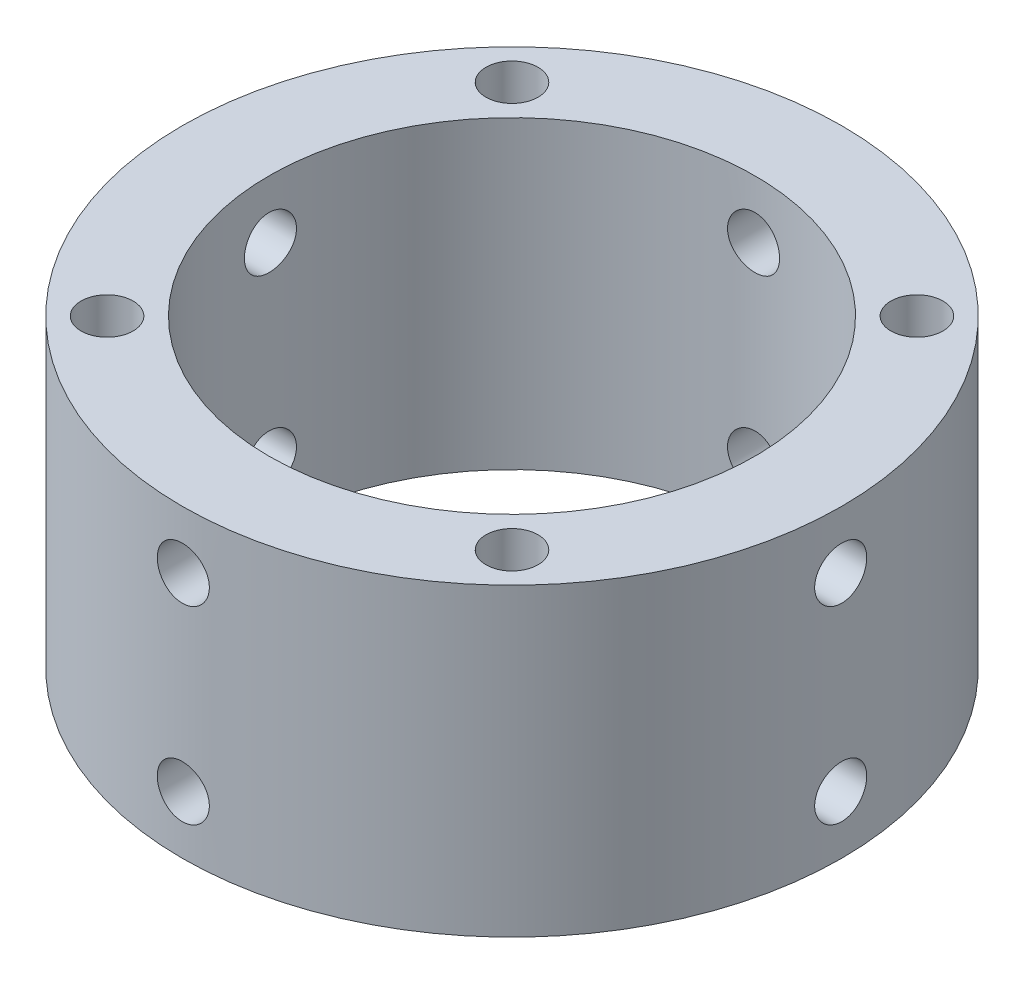
from build123d import *

# Parameters (mm, degrees)
SKETCH1_R           = 28.5
SKETCH1_R_2         = 21
BOSS_EXTRUDE1_DEPTH = 13.175
SKETCH2_R           = 2.25
CUT_EXTRUDE1_DEPTH  = 43.403780787
CIRPATTERN1_COUNT   = 4
SKETCH3_R           = 2.25
CUT_EXTRUDE2_DEPTH  = 49.154153681


with BuildPart() as part:
    # Sketch1 → Boss-Extrude1 (new, symmetric)
    with BuildSketch(Plane(origin=(0, 0, 0), x_dir=(1, 0, 0), z_dir=(0, 1, 0))):
        with Locations(Location((0, 0, 0), (0, 0, 90))):
            Circle(SKETCH1_R)
        with Locations(Location((0, 0, 0), (0, 0, 90))):
            Circle(SKETCH1_R_2, mode=Mode.SUBTRACT)
    extrude(amount=BOSS_EXTRUDE1_DEPTH, both=True)

    # Sketch2 → Cut-Extrude1 (cut, through all)
    with BuildSketch(Plane.XY):
        with Locations(Location((0, 8.175, 0), (0, 0, 90))):
            Circle(SKETCH2_R)
        with Locations(Location((0, -8.175, 0), (0, 0, 90))):
            Circle(SKETCH2_R)
    cut_extrude1 = extrude(amount=-CUT_EXTRUDE1_DEPTH, mode=Mode.SUBTRACT)

    # CirPattern1: Cut-Extrude1 ×4 about axis
    cirpattern1_axis = Axis((0, 13.175, 0), (0, -1, 0))
    for i in range(1, CIRPATTERN1_COUNT):
        add(cut_extrude1.rotate(cirpattern1_axis, i * 360 / CIRPATTERN1_COUNT), mode=Mode.SUBTRACT)

    # Sketch3 → Cut-Extrude2 (cut, through all)
    with BuildSketch(Plane(origin=(0, 13.175, 0), x_dir=(1, 0, 0), z_dir=(0, 1, 0))):
        with Locations(Location((17.500892834, 17.500892834, 0), (0, 0, 270))):
            Circle(SKETCH3_R)
        with Locations(Location((17.500892834, -17.500892834, 0), (0, 0, 270))):
            Circle(SKETCH3_R)
        with Locations(Location((-17.500892834, -17.500892834, 0), (0, 0, 270))):
            Circle(SKETCH3_R)
        with Locations(Location((-17.500892834, 17.500892834, 0), (0, 0, 270))):
            Circle(SKETCH3_R)
    extrude(amount=-CUT_EXTRUDE2_DEPTH, mode=Mode.SUBTRACT)


solid = part.part
